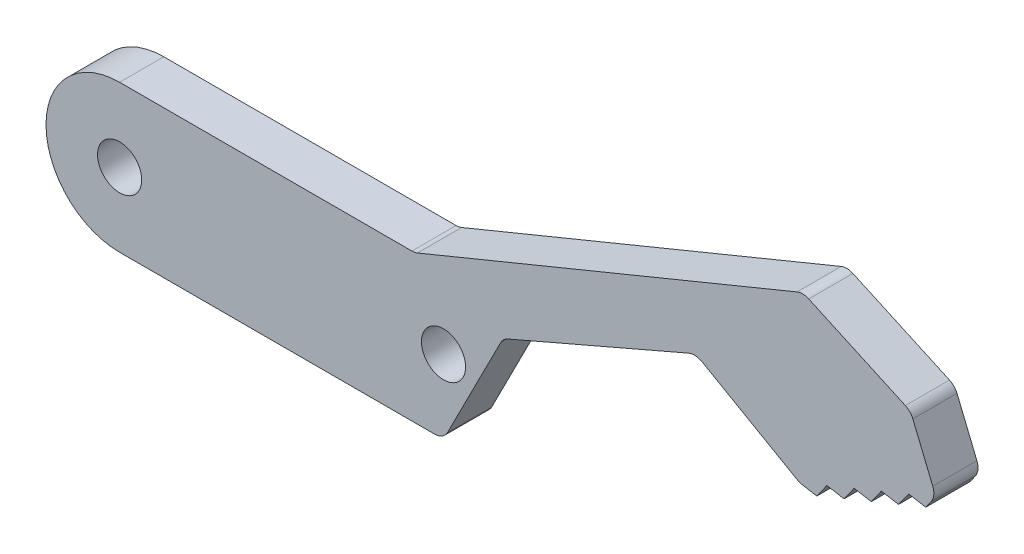
from build123d import *

# Parameters (mm, degrees)
SKETCH2_R           = 1.5
BOSS_EXTRUDE1_DEPTH = 3
FILLET1_R           = 1


with BuildPart() as part:
    # Sketch2 → Boss-Extrude1 (new body)
    with BuildSketch(Plane.XY):
        with BuildLine():
            Line((20.05, 5), (0, 5))
            ThreePointArc((0, 5), (-5, 0), (0, -5))
            Line((0, -5), (22, -5))
            Line((22, -5), (26.041872856, 2.943342287))
            Line((26.041872856, 2.943342287), (39.11411217, 8.590833705))
            Line((39.11411217, 8.590833705), (46.188488025, 4.540007042))
            Line((46.188488025, 4.540007042), (47.352932204, 4.337597171))
            Line((47.352932204, 4.337597171), (48.038244482, 5.300533868))
            Line((48.038244482, 5.300533868), (49.20268866, 5.098123997))
            Line((49.20268866, 5.098123997), (49.888000938, 6.061060693))
            Line((49.888000938, 6.061060693), (51.052445116, 5.858650822))
            Line((51.052445116, 5.858650822), (51.737757394, 6.821587519))
            Line((51.737757394, 6.821587519), (52.902201573, 6.619177648))
            Line((52.902201573, 6.619177648), (53.587513851, 7.582114344))
            Line((53.587513851, 7.582114344), (54.751958029, 7.379704473))
            Line((54.751958029, 7.379704473), (55.437270307, 8.34264117))
            Line((55.437270307, 8.34264117), (53.72608495, 12.504593197))
            Line((53.72608495, 12.504593197), (46.409029503, 15.837507263))
            Line((46.409029503, 15.837507263), (20.05, 5))
        make_face()
        Circle(SKETCH2_R, mode=Mode.SUBTRACT)
        with Locations((22, 0)):
            Circle(SKETCH2_R, mode=Mode.SUBTRACT)
    extrude(amount=BOSS_EXTRUDE1_DEPTH)

    # Fillet1
    fillet1_edges = [part.edges().sort_by_distance(p)[0] for p in [
        (22, -5, 1.5),
        (20.05, 5, 1.5),
        (46.409029503, 15.837507263, 1.5),
        (53.72608495, 12.504593197, 1.5),
        (55.437270307, 8.34264117, 1.5),
        (46.188488025, 4.540007042, 1.5),
        (39.11411217, 8.590833705, 1.5),
        (26.041872856, 2.943342287, 1.5),
    ]]
    fillet(fillet1_edges, radius=FILLET1_R)


solid = part.part
